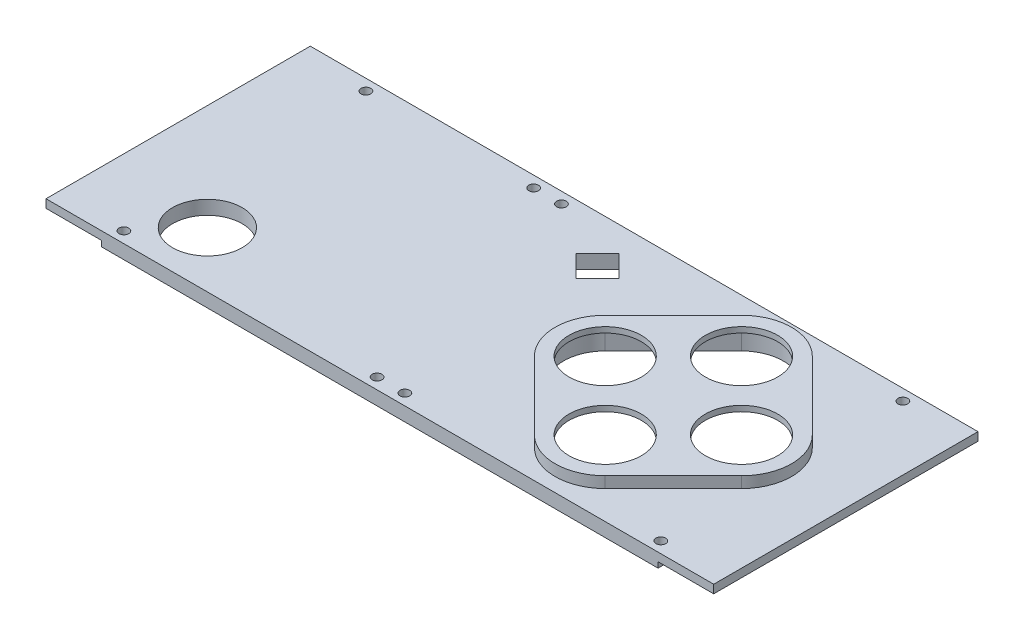
from build123d import *

# Parameters (mm, degrees)
SKETCH1_W           = 200
SKETCH1_H           = 95
SKETCH1_R           = 1.75
BOSS_EXTRUDE1_DEPTH = 5
SKETCH2_R           = 15
SKETCH2_R_2         = 12.5
CUT_EXTRUDE1_DEPTH  = 5
SKETCH4_W           = 16
SKETCH4_H           = 37
BOSS_EXTRUDE2_DEPTH = 4.2
SKETCH6_W           = 20
SKETCH6_H           = 95
BOSS_EXTRUDE3_DEPTH = 3
BOSS_EXTRUDE4_START = 4
BOSS_EXTRUDE4_DEPTH = 4
SKETCH9_R           = 13
BOSS_EXTRUDE5_DEPTH = 2
CUT_EXTRUDE2_DEPTH  = 5
SKETCH11_R          = 1.75
CUT_EXTRUDE3_DEPTH  = 10


with BuildPart() as part:
    # Sketch1 → Boss-Extrude1 (new body)
    with BuildSketch(Plane(origin=(0, 0, 0), x_dir=(1, 0, 0), z_dir=(0, 1, 0))):
        Rectangle(SKETCH1_W, SKETCH1_H)
        with Locations(Location((-96, 43.5, 0), (0, 0, 270))):
            Circle(SKETCH1_R, mode=Mode.SUBTRACT)
        with Locations(Location((-96, -43.5, 0), (0, 0, 270))):
            Circle(SKETCH1_R, mode=Mode.SUBTRACT)
        with Locations(Location((97, 43.5, 0), (0, 0, 270))):
            Circle(SKETCH1_R, mode=Mode.SUBTRACT)
        with Locations(Location((97, -43.5, 0), (0, 0, 270))):
            Circle(SKETCH1_R, mode=Mode.SUBTRACT)
    extrude(amount=BOSS_EXTRUDE1_DEPTH)

    # Sketch2 → Cut-Extrude1 (cut)
    with BuildSketch(Plane(origin=(0, 5, 0), x_dir=(1, 0, 0), z_dir=(0, 1, 0))):
        with Locations((33.5, 0)):
            Circle(SKETCH2_R)
        with BuildLine():
            ThreePointArc((48.5, 0), (39.240251485, -13.858192988), (22.893398282, -10.606601718))
            Line((22.893398282, -10.606601718), (47.393398282, -35.106601718))
            ThreePointArc((47.393398282, -35.106601718), (52.259748515, -10.641807012), (73, -24.5))
            ThreePointArc((73, -24.5), (71.858192988, -30.240251485), (68.606601718, -35.106601718))
            Line((68.606601718, -35.106601718), (93.106601718, -10.606601718))
            ThreePointArc((93.106601718, -10.606601718), (67.5, 0), (93.106601718, 10.606601718))
            Line((93.106601718, 10.606601718), (68.606601718, 35.106601718))
            ThreePointArc((68.606601718, 35.106601718), (71.858192988, 30.240251485), (73, 24.5))
            ThreePointArc((73, 24.5), (52.259748515, 10.641807012), (47.393398282, 35.106601718))
            Line((47.393398282, 35.106601718), (22.893398282, 10.606601718))
            ThreePointArc((22.893398282, 10.606601718), (39.240251485, 13.858192988), (48.5, 0))
        make_face()
        with Locations((58, -24.5)):
            Circle(SKETCH2_R)
        with Locations((82.5, 0)):
            Circle(SKETCH2_R)
        with Locations((58, 24.5)):
            Circle(SKETCH2_R)
        with Locations(Location((-82, -27.5, 0), (0, 0, 270))):
            Circle(SKETCH2_R_2)
    extrude(amount=-CUT_EXTRUDE1_DEPTH, mode=Mode.SUBTRACT)

    # Sketch4 → Boss-Extrude2 (add)
    with BuildSketch(Plane.XZ):
        with Locations((-82.5, -19.5)):
            Rectangle(SKETCH4_W, SKETCH4_H)
    extrude(amount=BOSS_EXTRUDE2_DEPTH)

    # Sketch6 → Boss-Extrude3 (add)
    with BuildSketch(Plane(origin=(0, 5, 0), x_dir=(1, 0, 0), z_dir=(0, 1, 0))):
        with Locations((-110, 0)):
            Rectangle(SKETCH6_W, SKETCH6_H)
        with Locations((110, 0)):
            Rectangle(SKETCH6_W, SKETCH6_H)
    extrude(amount=-BOSS_EXTRUDE3_DEPTH)

    # Sketch8 → Boss-Extrude4 (add)
    with BuildSketch(Plane(origin=(0, 5, 0), x_dir=(1, 0, 0), z_dir=(0, 1, 0)).offset(BOSS_EXTRUDE4_START)):
        with BuildLine():
            Line((70.727922061, -37.227922061), (95.227922061, -12.727922061))
            ThreePointArc((95.227922061, -12.727922061), (100.5, 0), (95.227922061, 12.727922061))
            Line((95.227922061, 12.727922061), (70.727922061, 37.227922061))
            ThreePointArc((70.727922061, 37.227922061), (58, 42.5), (45.272077939, 37.227922061))
            Line((45.272077939, 37.227922061), (20.772077939, 12.727922061))
            ThreePointArc((20.772077939, 12.727922061), (15.5, 0), (20.772077939, -12.727922061))
            Line((20.772077939, -12.727922061), (45.272077939, -37.227922061))
            ThreePointArc((45.272077939, -37.227922061), (58, -42.5), (70.727922061, -37.227922061))
        make_face()
        with BuildLine():
            Line((22.893398282, -10.606601718), (47.393398282, -35.106601718))
            ThreePointArc((47.393398282, -35.106601718), (58, -39.5), (68.606601718, -35.106601718))
            Line((68.606601718, -35.106601718), (93.106601718, -10.606601718))
            ThreePointArc((93.106601718, -10.606601718), (97.5, 0), (93.106601718, 10.606601718))
            Line((93.106601718, 10.606601718), (68.606601718, 35.106601718))
            ThreePointArc((68.606601718, 35.106601718), (58, 39.5), (47.393398282, 35.106601718))
            Line((47.393398282, 35.106601718), (22.893398282, 10.606601718))
            ThreePointArc((22.893398282, 10.606601718), (18.5, 0), (22.893398282, -10.606601718))
        make_face(mode=Mode.SUBTRACT)
    extrude(amount=-BOSS_EXTRUDE4_DEPTH)

    # Sketch9 → Boss-Extrude5 (add)
    with BuildSketch(Plane(origin=(0, 9, 0), x_dir=(1, 0, 0), z_dir=(0, 1, 0))):
        with BuildLine():
            Line((22.893398282, -10.606601718), (47.393398282, -35.106601718))
            ThreePointArc((47.393398282, -35.106601718), (58, -39.5), (68.606601718, -35.106601718))
            Line((68.606601718, -35.106601718), (93.106601718, -10.606601718))
            ThreePointArc((93.106601718, -10.606601718), (97.5, 0), (93.106601718, 10.606601718))
            Line((93.106601718, 10.606601718), (68.606601718, 35.106601718))
            ThreePointArc((68.606601718, 35.106601718), (58, 39.5), (47.393398282, 35.106601718))
            Line((47.393398282, 35.106601718), (22.893398282, 10.606601718))
            ThreePointArc((22.893398282, 10.606601718), (18.5, 0), (22.893398282, -10.606601718))
        make_face()
        with Locations(Location((58, 24.5, 0), (0, 0, 270))):
            Circle(SKETCH9_R, mode=Mode.SUBTRACT)
        with Locations(Location((82.5, 0, 0), (0, 0, 270))):
            Circle(SKETCH9_R, mode=Mode.SUBTRACT)
        with Locations(Location((58, -24.5, 0), (0, 0, 270))):
            Circle(SKETCH9_R, mode=Mode.SUBTRACT)
        with Locations(Location((33.5, 0, 0), (0, 0, 270))):
            Circle(SKETCH9_R, mode=Mode.SUBTRACT)
    extrude(amount=-BOSS_EXTRUDE5_DEPTH)

    # Sketch10 → Cut-Extrude2 (cut)
    with BuildSketch(Plane(origin=(0, 5, 0), x_dir=(1, 0, 0), z_dir=(0, 1, 0))):
        Polygon((0, 38.5), (-7.778174593, 30.721825407), (0, 22.943650814), (7.778174593, 30.721825407), align=None)
    extrude(amount=-CUT_EXTRUDE2_DEPTH, mode=Mode.SUBTRACT)

    # Sketch11 → Cut-Extrude3 (cut)
    with BuildSketch(Plane(origin=(0, 5, 0), x_dir=(1, 0, 0), z_dir=(0, 1, 0))):
        with Locations(Location((-35.721825407, 43.5, 0), (0, 0, 270))):
            Circle(SKETCH11_R)
        with Locations(Location((-25.721825407, 43.5, 0), (0, 0, 270))):
            Circle(SKETCH11_R)
        with Locations(Location((5, -43.5, 0), (0, 0, 270))):
            Circle(SKETCH11_R)
        with Locations(Location((-5, -43.5, 0), (0, 0, 270))):
            Circle(SKETCH11_R)
    extrude(amount=-CUT_EXTRUDE3_DEPTH, mode=Mode.SUBTRACT)


solid = part.part
